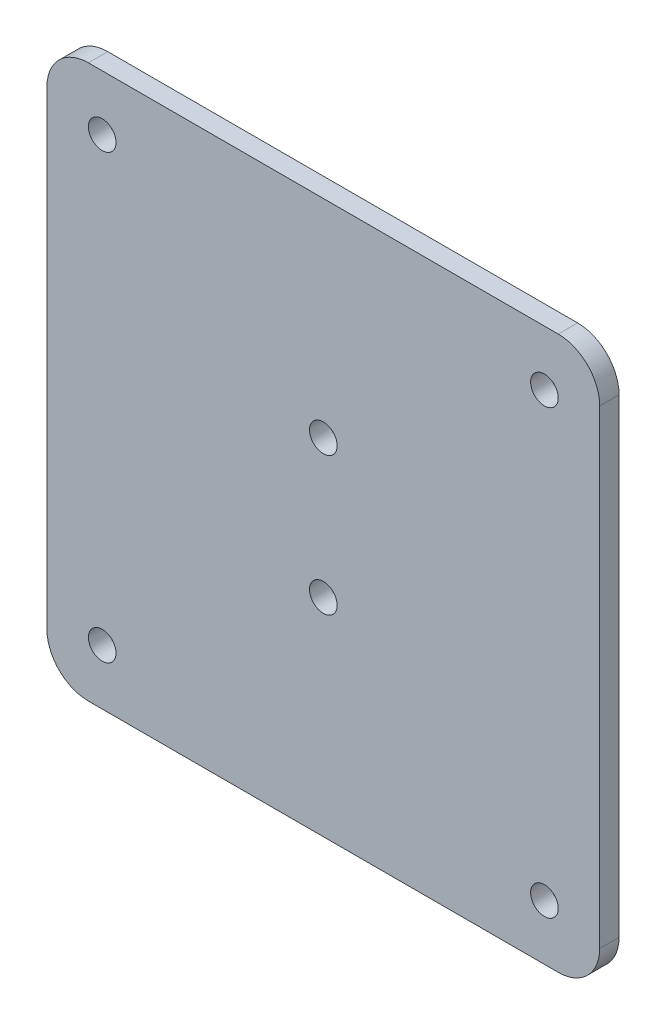
from build123d import *

# Parameters (mm, degrees)
ESQUISSE3_W             = 200
ESQUISSE3_H             = 200
ESQUISSE3_R             = 5
BOSS_EXTRU_2_DEPTH      = 7
CONG_1_R                = 15
ESQUISSE4_R             = 5
ENL_V_MAT_EXTRU_1_DEPTH = 10


with BuildPart() as part:
    # Esquisse3 → Boss.-Extru.2 (new body)
    with BuildSketch(Plane.XY):
        Rectangle(ESQUISSE3_W, ESQUISSE3_H)
        with Locations((80, 80)):
            Circle(ESQUISSE3_R, mode=Mode.SUBTRACT)
        with Locations((80, -80)):
            Circle(ESQUISSE3_R, mode=Mode.SUBTRACT)
        with Locations((-80, -80)):
            Circle(ESQUISSE3_R, mode=Mode.SUBTRACT)
        with Locations((-80, 80)):
            Circle(ESQUISSE3_R, mode=Mode.SUBTRACT)
    extrude(amount=BOSS_EXTRU_2_DEPTH)

    # Congé1
    cong_1_edges = [part.edges().sort_by_distance(p)[0] for p in [
        (-100, 100, 3.5),
        (100, 100, 3.5),
        (100, -100, 3.5),
        (-100, -100, 3.5),
    ]]
    fillet(cong_1_edges, radius=CONG_1_R)

    # Esquisse4 → Enlèv. mat.-Extru.1 (cut)
    with BuildSketch(Plane(origin=(0, 0, 0), x_dir=(-1, 0, 0), z_dir=(0, 0, -1))):
        with Locations((0, -25)):
            Circle(ESQUISSE4_R)
        with Locations((0, 25)):
            Circle(ESQUISSE4_R)
    extrude(amount=-ENL_V_MAT_EXTRU_1_DEPTH, mode=Mode.SUBTRACT)


solid = part.part
